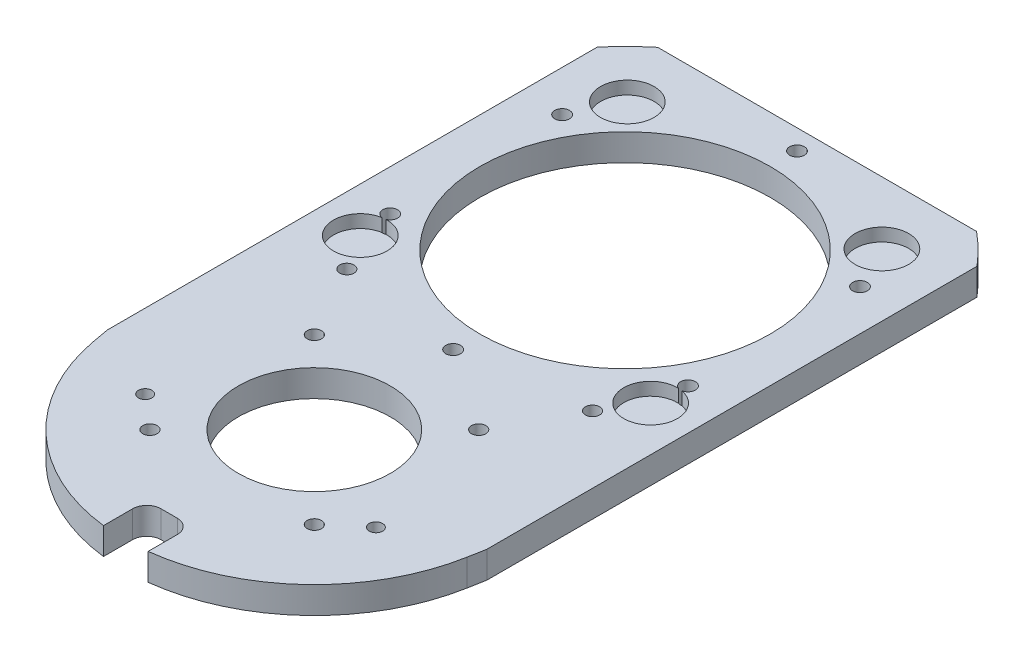
from build123d import *

# Parameters (mm, degrees)
SKETCH1_R            = 32.5
SKETCH1_R_2          = 17
BOSS_EXTRUDE1_DEPTH  = 6
SKETCH2_R            = 1.6
CUT_EXTRUDE1_DEPTH   = 6
LPATTERN1_COUNT      = 2
LPATTERN1_PITCH      = 36.8
LPATTERN1_COUNT_DIR2 = 2
LPATTERN1_PITCH_DIR2 = 36.8
SKETCH3_R            = 1.65
CUT_EXTRUDE2_DEPTH   = 10
CIRPATTERN1_COUNT    = 6
SKETCH6_W            = 10
SKETCH6_H            = 20
CUT_EXTRUDE4_DEPTH   = 10
SKETCH7_R            = 1.6
SKETCH7_R_2          = 1.5
CUT_EXTRUDE5_DEPTH   = 20
FILLET1_R            = 3.175
CUT_EXTRUDE6_START   = 3.1
SKETCH8_R            = 6
CUT_EXTRUDE6_DEPTH   = 20


with BuildPart() as part:
    # Sketch1 → Boss-Extrude1 (new body)
    with BuildSketch(Plane(origin=(0, 0, 0), x_dir=(1, 0, 0), z_dir=(0, 1, 0))):
        with BuildLine():
            Line((-42.5, -73.411966665), (-41.810700901, -77.192472856))
            ThreePointArc((-41.810700901, -77.192472856), (0, -112.069134335), (41.810700901, -77.192472856))
            Line((41.810700901, -77.192472856), (42.5, -73.411966665))
            Line((42.5, -73.411966665), (42.5, 36.289181897))
            ThreePointArc((42.5, 36.289181897), (39.241370505, 39.790319974), (35.695303931, 43))
            Line((35.695303931, 43), (-35.695303931, 43))
            ThreePointArc((-35.695303931, 43), (-39.241370505, 39.790319974), (-42.5, 36.289181897))
            Line((-42.5, 36.289181897), (-42.5, -73.411966665))
        make_face()
        with Locations(Location((0, 0, 0), (0, 0, 270))):
            Circle(SKETCH1_R, mode=Mode.SUBTRACT)
        with Locations(Location((0, -69.569134335, 0), (0, 0, 270))):
            Circle(SKETCH1_R_2, mode=Mode.SUBTRACT)
    extrude(amount=BOSS_EXTRUDE1_DEPTH)

    # Sketch2 → Cut-Extrude1 (cut)
    with BuildSketch(Plane(origin=(0, 6, 0), x_dir=(1, 0, 0), z_dir=(0, 1, 0))):
        with Locations(Location((18.4, -51.169134335, 0), (0, 0, 270))):
            Circle(SKETCH2_R)
    cut_extrude1 = extrude(amount=-CUT_EXTRUDE1_DEPTH, mode=Mode.SUBTRACT)

    # LPattern1: Cut-Extrude1 2 × 2
    with Locations(*[(-j * LPATTERN1_PITCH_DIR2, 0, i * LPATTERN1_PITCH) for i in range(LPATTERN1_COUNT) for j in range(LPATTERN1_COUNT_DIR2) if (i, j) != (0, 0)]):
        add(cut_extrude1, mode=Mode.SUBTRACT)

    # Sketch3 → Cut-Extrude2 (cut)
    with BuildSketch(Plane(origin=(0, 6, 0), x_dir=(1, 0, 0), z_dir=(0, 1, 0))):
        with Locations(Location((0, 38.5, 0), (0, 0, 270))):
            Circle(SKETCH3_R)
    cut_extrude2 = extrude(amount=-CUT_EXTRUDE2_DEPTH, mode=Mode.SUBTRACT)

    # CirPattern1: Cut-Extrude2 ×6 about axis
    cirpattern1_axis = Axis((0, 0, 0), (0, 1, 0))
    for i in range(1, CIRPATTERN1_COUNT):
        add(cut_extrude2.rotate(cirpattern1_axis, i * 360 / CIRPATTERN1_COUNT), mode=Mode.SUBTRACT)

    # Sketch6 → Cut-Extrude4 (cut)
    with BuildSketch(Plane(origin=(0, 6, 0), x_dir=(1, 0, 0), z_dir=(0, 1, 0))):
        with Locations((0, -112.069134335)):
            Rectangle(SKETCH6_W, SKETCH6_H)
    extrude(amount=-CUT_EXTRUDE4_DEPTH, mode=Mode.SUBTRACT)

    # Sketch7 → Cut-Extrude5 (cut)
    with BuildSketch(Plane(origin=(0, 0, 0), x_dir=(1, 0, 0), z_dir=(0, 1, 0))):
        with Locations(Location((-27.5, -34.784567168, 0), (0, 0, 270))):
            Circle(SKETCH7_R)
        with Locations(Location((-25.829771931, -81.613754795, 0), (0, 0, 270))):
            Circle(SKETCH7_R_2)
        with Locations(Location((25.829771931, -81.613754795, 0), (0, 0, 270))):
            Circle(SKETCH7_R_2)
        with Locations(Location((27.5, -34.784567168, 0), (0, 0, 270))):
            Circle(SKETCH7_R)
    extrude(amount=CUT_EXTRUDE5_DEPTH, mode=Mode.SUBTRACT)

    # Fillet1
    fillet1_edges = [part.edges().sort_by_distance(p)[0] for p in [
        (-5, 3, 102.069134335),
        (5, 3, 102.069134335),
    ]]
    fillet(fillet1_edges, radius=FILLET1_R)

    # Sketch8 → Cut-Extrude6 (cut)
    with BuildSketch(Plane(origin=(0, 0, 0), x_dir=(1, 0, 0), z_dir=(0, 1, 0)).offset(CUT_EXTRUDE6_START)):
        with Locations(Location((-28.5, 29, 0), (0, 0, 270))):
            Circle(SKETCH8_R)
        with Locations((-32.5, -26.784567168)):
            Circle(SKETCH8_R)
        with Locations((32.5, -26.784567168)):
            Circle(SKETCH8_R)
        with Locations(Location((28.5, 29, 0), (0, 0, 270))):
            Circle(SKETCH8_R)
    extrude(amount=CUT_EXTRUDE6_DEPTH, mode=Mode.SUBTRACT)


solid = part.part
